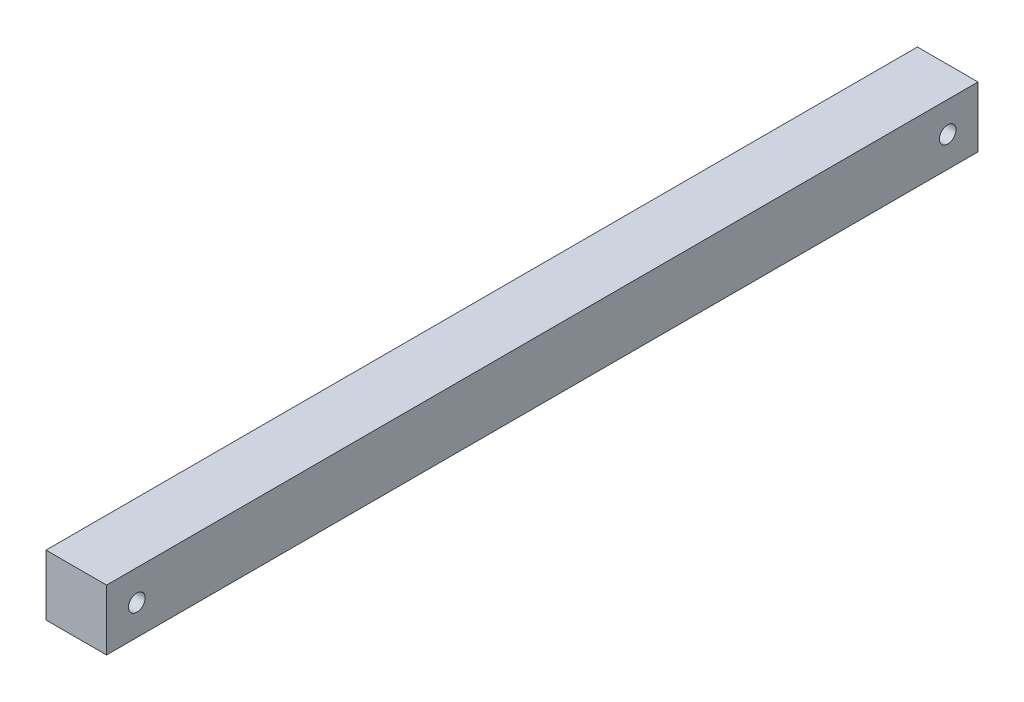
from build123d import *

# Parameters (mm, degrees)
SKETCH1_W           = 25.4
SKETCH1_H           = 25.4
BOSS_EXTRUDE1_DEPTH = 365.4
SKETCH10_R          = 3.5
CUT_EXTRUDE6_DEPTH  = 367.501855384


with BuildPart() as part:
    # Sketch1 → Boss-Extrude1 (new body)
    with BuildSketch(Plane.XY):
        Rectangle(SKETCH1_W, SKETCH1_H)
    extrude(amount=BOSS_EXTRUDE1_DEPTH)

    # Sketch10 → Cut-Extrude6 (cut, through all)
    with BuildSketch(Plane.ZY.offset(12.7)):
        with Locations((352.7, 0)):
            Circle(SKETCH10_R)
        with Locations(Location((12.7, 0, 0), (0, 0, 180))):
            Circle(SKETCH10_R)
    extrude(amount=-CUT_EXTRUDE6_DEPTH, mode=Mode.SUBTRACT)


solid = part.part
